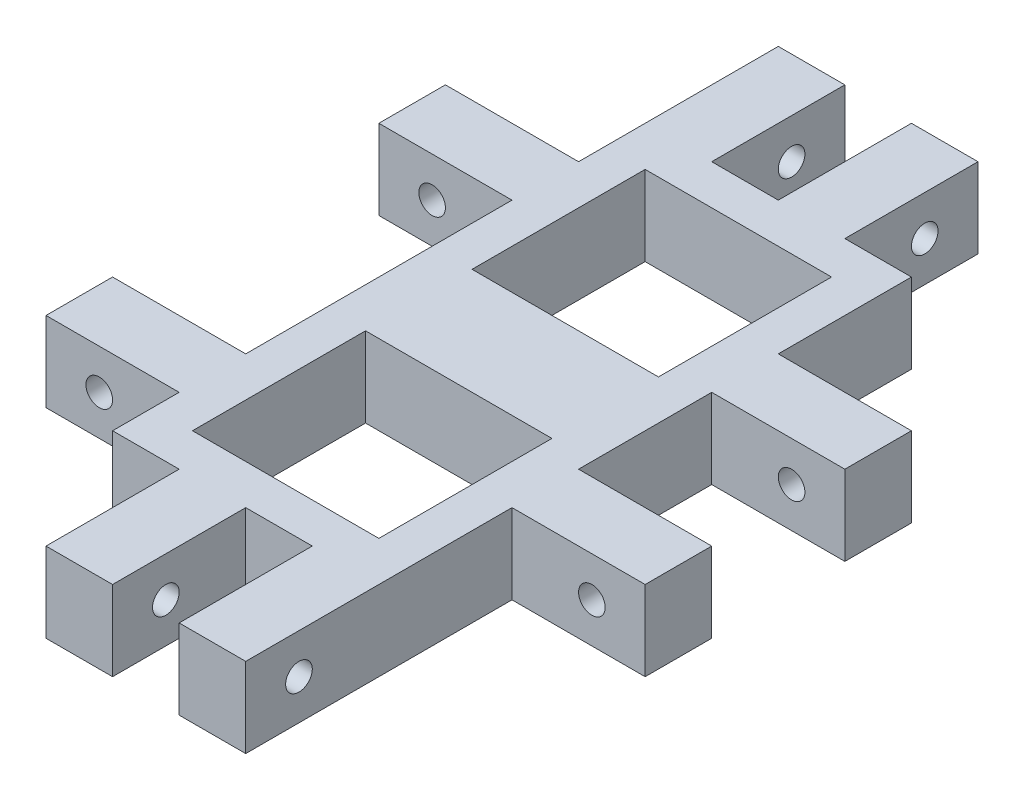
from build123d import *

# Parameters (mm, degrees)
ESBO_O1_W                = 20
ESBO_O1_H                = 6
RESSALTO_EXTRUS_O1_DEPTH = 40
ESBO_O2_W                = 10
ESBO_O2_H                = 5
ESBO_O2_W_2              = 5
ESBO_O2_H_2              = 10
RESSALTO_EXTRUS_O2_DEPTH = 6
ESBO_O3_R                = 1
CORTE_EXTRUS_O1_DEPTH    = 40
ESBO_O4_R                = 1
CORTE_EXTRUS_O2_DEPTH    = 40
ESBO_O5_R                = 1
CORTE_EXTRUS_O3_DEPTH    = 40
ESBO_O6_R                = 1
CORTE_EXTRUS_O4_DEPTH    = 40
ESBO_O7_W                = 14
ESBO_O7_H                = 13
CORTE_EXTRUS_O5_DEPTH    = 40


with BuildPart() as part:
    # Esboço1 → Ressalto-extrusão1 (new body)
    with BuildSketch(Plane.XY):
        with Locations((0.415187471, 0.908205796)):
            Rectangle(ESBO_O1_W, ESBO_O1_H)
    extrude(amount=RESSALTO_EXTRUS_O1_DEPTH)

    # Esboço2 → Ressalto-extrusão2 (add, through all)
    with BuildSketch(Plane(origin=(0, 3.908205796, 0), x_dir=(1, 0, 0), z_dir=(0, 1, 0))):
        with Locations((-14.584812529, -7.5)):
            Rectangle(ESBO_O2_W, ESBO_O2_H)
        with Locations((-14.584812529, -32.5)):
            Rectangle(ESBO_O2_W, ESBO_O2_H)
        with Locations((-7.084812529, 5)):
            Rectangle(ESBO_O2_W_2, ESBO_O2_H_2)
        with Locations((2.915187471, 5)):
            Rectangle(ESBO_O2_W_2, ESBO_O2_H_2)
        with Locations((15.415187471, -12.5)):
            Rectangle(ESBO_O2_W, ESBO_O2_H)
        with Locations((15.415187471, -27.5)):
            Rectangle(ESBO_O2_W, ESBO_O2_H)
        with Locations((-2.084812529, -45)):
            Rectangle(ESBO_O2_W_2, ESBO_O2_H_2)
        with Locations((7.915187471, -45)):
            Rectangle(ESBO_O2_W_2, ESBO_O2_H_2)
    extrude(amount=-RESSALTO_EXTRUS_O2_DEPTH)

    # Esboço3 → Corte-extrusão1 (cut)
    with BuildSketch(Plane.XY.offset(30)):
        with Locations((16.415187471, 0.908205796)):
            Circle(ESBO_O3_R)
    extrude(amount=-CORTE_EXTRUS_O1_DEPTH, mode=Mode.SUBTRACT)

    # Esboço4 → Corte-extrusão2 (cut)
    with BuildSketch(Plane.ZY.offset(4.584812529)):
        with Locations((46, 0.908205796)):
            Circle(ESBO_O4_R)
    extrude(amount=-CORTE_EXTRUS_O2_DEPTH, mode=Mode.SUBTRACT)

    # Esboço5 → Corte-extrusão3 (cut)
    with BuildSketch(Plane.XY.offset(35)):
        with Locations((-15.584812529, 0.908205796)):
            Circle(ESBO_O5_R)
    extrude(amount=-CORTE_EXTRUS_O3_DEPTH, mode=Mode.SUBTRACT)

    # Esboço6 → Corte-extrusão4 (cut)
    with BuildSketch(Plane(origin=(5.415187471, 0, 0), x_dir=(0, 0, -1), z_dir=(1, 0, 0))):
        with Locations((6, 0.908205796)):
            Circle(ESBO_O6_R)
    extrude(amount=-CORTE_EXTRUS_O4_DEPTH, mode=Mode.SUBTRACT)

    # Esboço7 → Corte-extrusão5 (cut)
    with BuildSketch(Plane(origin=(0, 3.908205796, 0), x_dir=(1, 0, 0), z_dir=(0, 1, 0))):
        with Locations((0.415187471, -9.5)):
            Rectangle(ESBO_O7_W, ESBO_O7_H)
        with Locations((0.415187471, -30.5)):
            Rectangle(ESBO_O7_W, ESBO_O7_H)
    extrude(amount=-CORTE_EXTRUS_O5_DEPTH, mode=Mode.SUBTRACT)


solid = part.part
